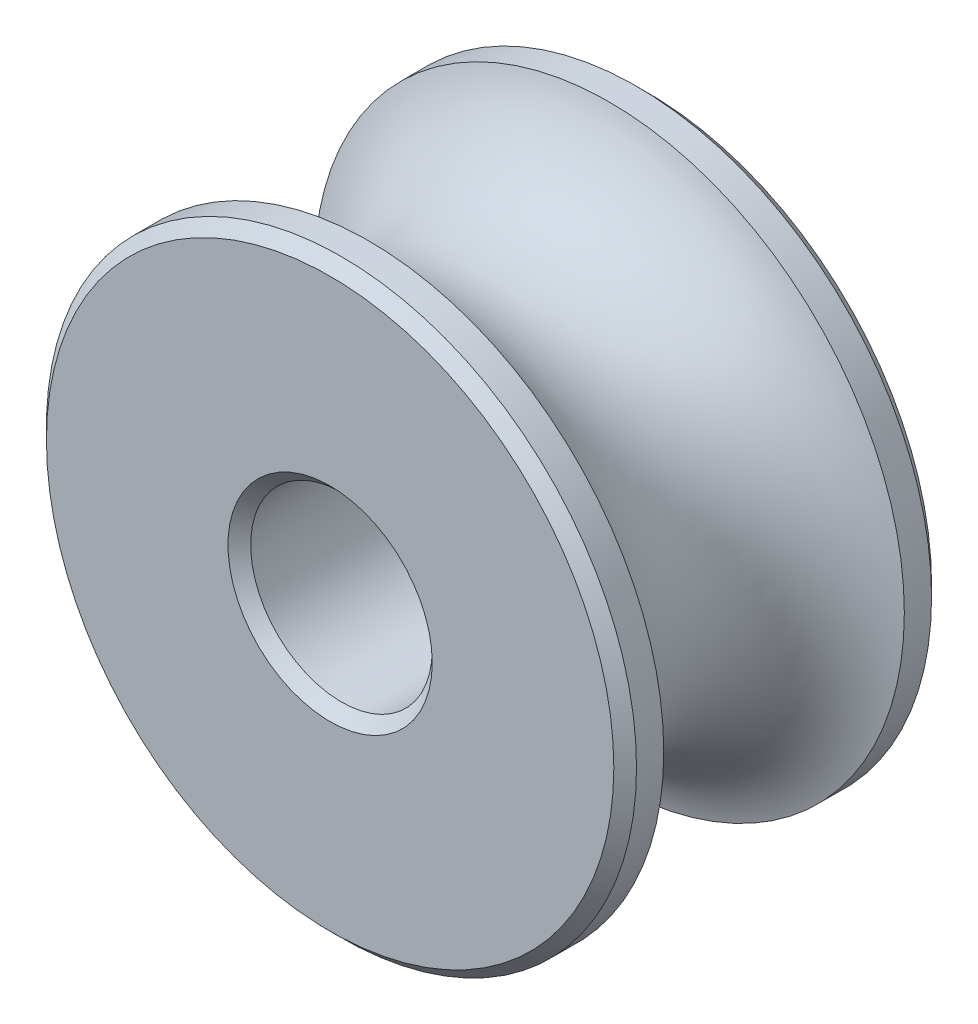
from build123d import *


with BuildPart() as part:
    # Sketch1 → Revolve1 (revolve)
    with BuildSketch(Plane(origin=(0, 28.574866342, 0), x_dir=(1, 0, 0), z_dir=(0, 1, 0))):
        with BuildLine():
            Line((-120.681601968, -17.71), (-120.931601968, -17.46))
            Line((-120.931601968, -17.46), (-124.931601968, -17.46))
            Line((-124.931601968, -17.46), (-125.181601968, -17.71))
            Line((-125.181601968, -17.71), (-125.181601968, -24.21))
            Line((-125.181601968, -24.21), (-124.931601968, -24.46))
            Line((-124.931601968, -24.46), (-120.931601968, -24.46))
            Line((-120.931601968, -24.46), (-120.681601968, -24.21))
            Line((-120.681601968, -24.21), (-120.681601968, -23.61))
            ThreePointArc((-120.681601968, -23.61), (-122.681601968, -20.96), (-120.681601968, -18.31))
            Line((-120.681601968, -18.31), (-120.681601968, -17.71))
        make_face()
    revolve(axis=Axis((-127.181601968, 28.574866342, 17.46), (0, 0, 1)))


solid = part.part
